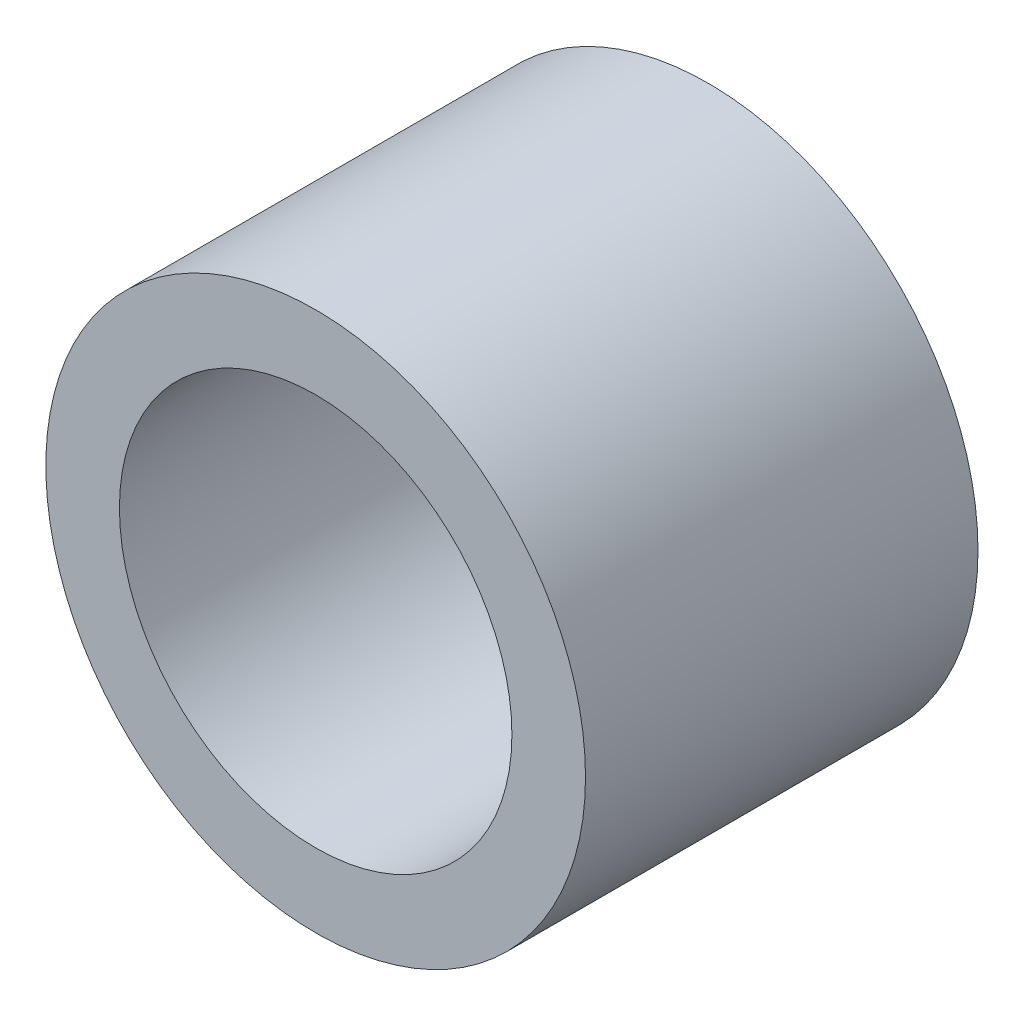
from build123d import *

# Parameters (mm, degrees)
SKETCH1_R           = 5.5
SKETCH1_R_2         = 4
BOSS_EXTRUDE1_DEPTH = 8


with BuildPart() as part:
    # Sketch1 → Boss-Extrude1 (new body)
    with BuildSketch(Plane.XY):
        Circle(SKETCH1_R)
        Circle(SKETCH1_R_2, mode=Mode.SUBTRACT)
    extrude(amount=BOSS_EXTRUDE1_DEPTH)


solid = part.part
